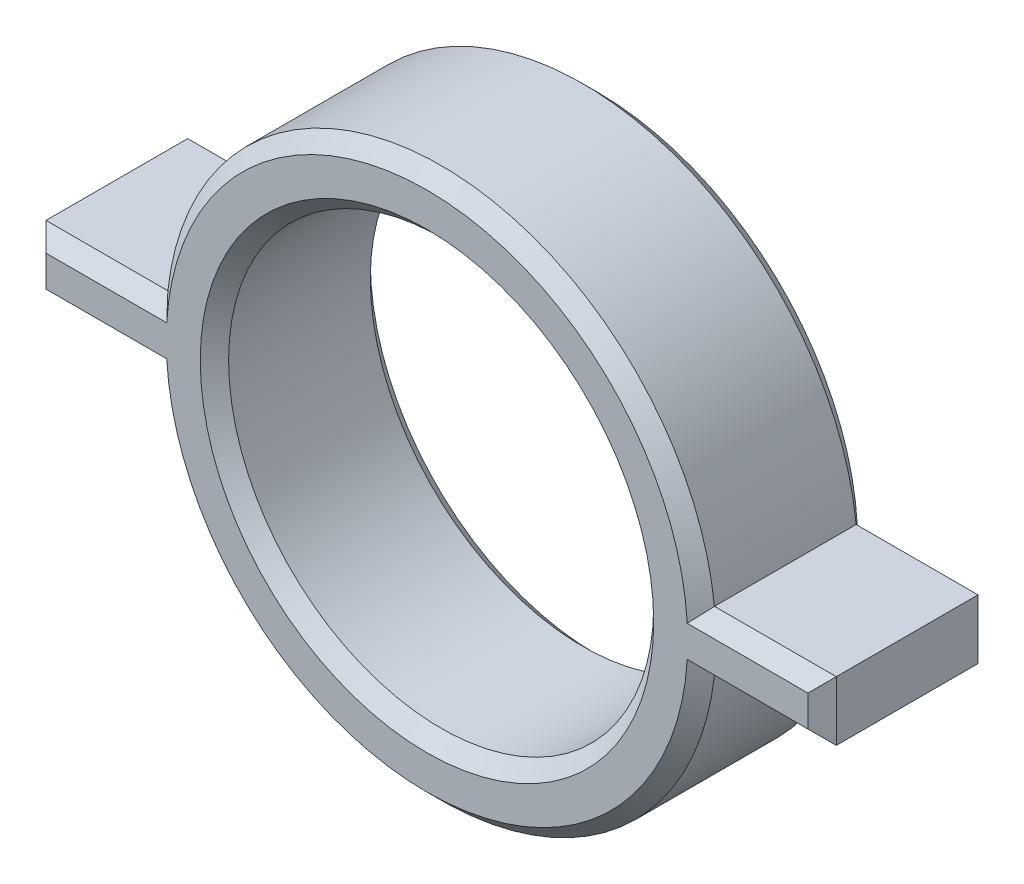
from build123d import *

# Parameters (mm, degrees)
SKETCH1_R           = 7.5
BOSS_EXTRUDE1_DEPTH = 6
CHAMFER1_SIZE       = 0.5


with BuildPart() as part:
    # Sketch1 → Boss-Extrude1 (new body)
    with BuildSketch(Plane.XY):
        with BuildLine():
            Line((9.643002644, -1.05), (13.943002644, -1.05))
            Line((13.943002644, -1.05), (13.943002644, 1.05))
            Line((13.943002644, 1.05), (9.643002644, 1.05))
            ThreePointArc((9.643002644, 1.05), (0, 9.7), (-9.643002644, 1.05))
            Line((-9.643002644, 1.05), (-13.943002644, 1.05))
            Line((-13.943002644, 1.05), (-13.943002644, -1.05))
            Line((-13.943002644, -1.05), (-9.643002644, -1.05))
            ThreePointArc((-9.643002644, -1.05), (0, -9.7), (9.643002644, -1.05))
        make_face()
        Circle(SKETCH1_R, mode=Mode.SUBTRACT)
    extrude(amount=BOSS_EXTRUDE1_DEPTH)

    # Chamfer1
    chamfer1_edges = [part.edges().sort_by_distance(p)[0] for p in [
        (0, -9.7, 0),
        (-11.793002644, -1.05, 0),
        (-13.943002644, 0, 0),
        (-11.793002644, 1.05, 0),
        (-11.793002644, -1.05, 6),
        (0, -9.7, 6),
        (11.793002644, -1.05, 6),
        (-7.5, 0, 0),
        (-7.5, 0, 6),
        (13.943002644, 0, 6),
        (11.793002644, 1.05, 6),
        (0, 9.7, 6),
        (-11.793002644, 1.05, 6),
        (0, 9.7, 0),
        (-13.943002644, 0, 6),
        (11.793002644, 1.05, 0),
        (13.943002644, 0, 0),
        (11.793002644, -1.05, 0),
    ]]
    chamfer(chamfer1_edges, length=CHAMFER1_SIZE)


solid = part.part
